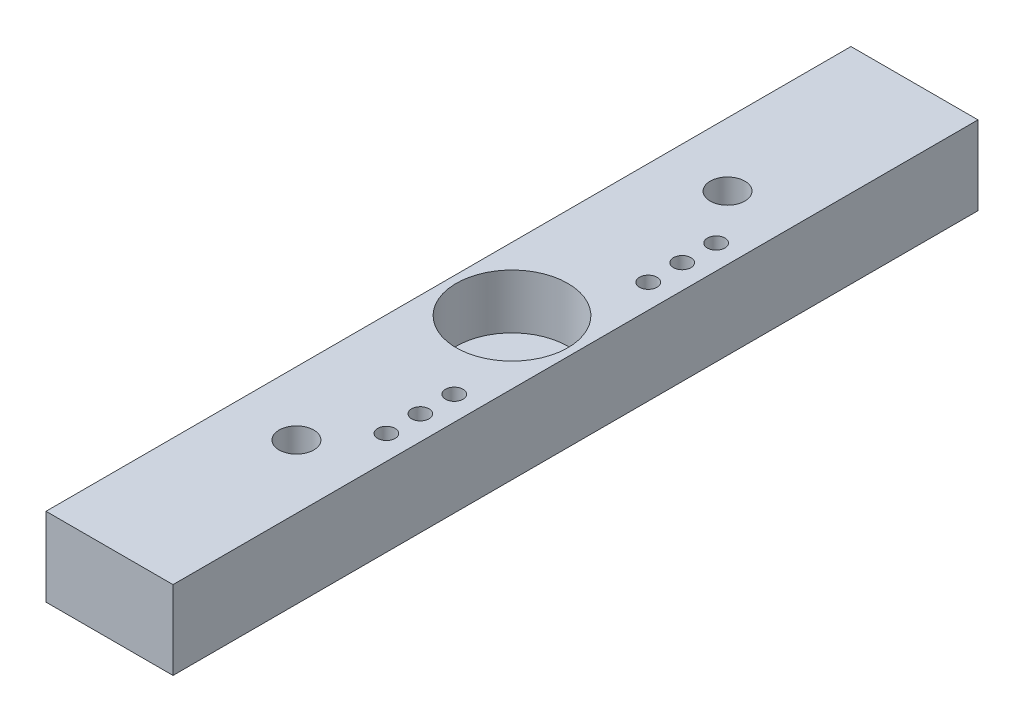
from build123d import *

# Parameters (mm, degrees)
SKETCH1_W         = 38.1
SKETCH1_H         = 166
SKETCH1_R         = 11.509375
SKETCH1_R_2       = 3.571875
EXTRUSION1_DEPTH  = 25.4
EXTRUSION15_REACH = 171.009
SKETCH2_W         = 38.1
SKETCH2_H         = 9.170812283
EXTRUSION18_REACH = 90.865
SKETCH4_R         = 1.8
SKETCH4_W         = 5.953125
SKETCH4_H         = 166
SKETCH5_R         = 3.571875
SKETCH5_R_2       = 11.509375
EXTRUSION19_DEPTH = 5


with BuildPart() as part:
    # Sketch1 → Extrusion1 (new body)
    with BuildSketch(Plane(origin=(0, 0, 0), x_dir=(-1, 0, 0), z_dir=(0, 1, 0))):
        Rectangle(SKETCH1_W, SKETCH1_H)
        with Locations(Location((0, 0, 0), (0, 0, 270))):
            Circle(SKETCH1_R, mode=Mode.SUBTRACT)
        with Locations(Location((0, -44.45, 0), (0, 0, 270))):
            Circle(SKETCH1_R_2, mode=Mode.SUBTRACT)
        with Locations(Location((0, 44.45, 0), (0, 0, 270))):
            Circle(SKETCH1_R_2, mode=Mode.SUBTRACT)
    extrude(amount=EXTRUSION1_DEPTH)

    # Sketch2 → Extrusion15 (cut, up to next)
    with BuildSketch(Plane(origin=(0, 0, -83), x_dir=(-1, 0, 0), z_dir=(0, 0, -1)), mode=Mode.PRIVATE) as extrusion15_sk1:
        with Locations((0, 20.814593859)):
            Rectangle(SKETCH2_W, SKETCH2_H)
    extrusion15_tool1 = extrude(extrusion15_sk1.sketch, amount=-EXTRUSION15_REACH, mode=Mode.PRIVATE) & part.part
    add(extrusion15_tool1.solids().sort_by_distance((0, 20.814594, -83))[0], mode=Mode.SUBTRACT)

    # Sketch4 → Extrusion18 (cut, up to next)
    with BuildSketch(Plane(origin=(0, 25.4, 0), x_dir=(1, 0, 0), z_dir=(0, 1, 0)), mode=Mode.PRIVATE) as extrusion18_sk1:
        with Locations(Location((8.096875, -34, 0), (0, 0, 270))):
            Circle(SKETCH4_R)
    extrusion18_tool1 = extrude(extrusion18_sk1.sketch, amount=-EXTRUSION18_REACH, mode=Mode.PRIVATE) & part.part
    # Sketch4 → Extrusion18 (cut, up to next)
    with BuildSketch(Plane(origin=(0, 25.4, 0), x_dir=(1, 0, 0), z_dir=(0, 1, 0)), mode=Mode.PRIVATE) as extrusion18_sk2:
        with Locations(Location((8.096875, -27, 0), (0, 0, 270))):
            Circle(SKETCH4_R)
    extrusion18_tool2 = extrude(extrusion18_sk2.sketch, amount=-EXTRUSION18_REACH, mode=Mode.PRIVATE) & part.part
    # Sketch4 → Extrusion18 (cut, up to next)
    with BuildSketch(Plane(origin=(0, 25.4, 0), x_dir=(1, 0, 0), z_dir=(0, 1, 0)), mode=Mode.PRIVATE) as extrusion18_sk3:
        with Locations(Location((8.096875, -20, 0), (0, 0, 270))):
            Circle(SKETCH4_R)
    extrusion18_tool3 = extrude(extrusion18_sk3.sketch, amount=-EXTRUSION18_REACH, mode=Mode.PRIVATE) & part.part
    # Sketch4 → Extrusion18 (cut, up to next)
    with BuildSketch(Plane(origin=(0, 25.4, 0), x_dir=(1, 0, 0), z_dir=(0, 1, 0)), mode=Mode.PRIVATE) as extrusion18_sk4:
        with Locations(Location((8.096875, 20, 0), (0, 0, 270))):
            Circle(SKETCH4_R)
    extrusion18_tool4 = extrude(extrusion18_sk4.sketch, amount=-EXTRUSION18_REACH, mode=Mode.PRIVATE) & part.part
    # Sketch4 → Extrusion18 (cut, up to next)
    with BuildSketch(Plane(origin=(0, 25.4, 0), x_dir=(1, 0, 0), z_dir=(0, 1, 0)), mode=Mode.PRIVATE) as extrusion18_sk5:
        with Locations(Location((8.096875, 27, 0), (0, 0, 270))):
            Circle(SKETCH4_R)
    extrusion18_tool5 = extrude(extrusion18_sk5.sketch, amount=-EXTRUSION18_REACH, mode=Mode.PRIVATE) & part.part
    # Sketch4 → Extrusion18 (cut, up to next)
    with BuildSketch(Plane(origin=(0, 25.4, 0), x_dir=(1, 0, 0), z_dir=(0, 1, 0)), mode=Mode.PRIVATE) as extrusion18_sk6:
        with Locations(Location((8.096875, 34, 0), (0, 0, 270))):
            Circle(SKETCH4_R)
    extrusion18_tool6 = extrude(extrusion18_sk6.sketch, amount=-EXTRUSION18_REACH, mode=Mode.PRIVATE) & part.part
    # Sketch4 → Extrusion18 (cut, up to next)
    with BuildSketch(Plane(origin=(0, 25.4, 0), x_dir=(1, 0, 0), z_dir=(0, 1, 0)), mode=Mode.PRIVATE) as extrusion18_sk7:
        with Locations((-16.0734375, 0)):
            Rectangle(SKETCH4_W, SKETCH4_H)
    extrusion18_tool7 = extrude(extrusion18_sk7.sketch, amount=-EXTRUSION18_REACH, mode=Mode.PRIVATE) & part.part
    # Sketch4 → Extrusion18 (cut, up to next)
    with BuildSketch(Plane(origin=(0, 25.4, 0), x_dir=(1, 0, 0), z_dir=(0, 1, 0)), mode=Mode.PRIVATE) as extrusion18_sk8:
        with Locations((16.0734375, 0)):
            Rectangle(SKETCH4_W, SKETCH4_H)
    extrusion18_tool8 = extrude(extrusion18_sk8.sketch, amount=-EXTRUSION18_REACH, mode=Mode.PRIVATE) & part.part
    add(extrusion18_tool1.solids().sort_by_distance((8.096875, 25.4, 34))[0], mode=Mode.SUBTRACT)
    add(extrusion18_tool2.solids().sort_by_distance((8.096875, 25.4, 27))[0], mode=Mode.SUBTRACT)
    add(extrusion18_tool3.solids().sort_by_distance((8.096875, 25.4, 20))[0], mode=Mode.SUBTRACT)
    add(extrusion18_tool4.solids().sort_by_distance((8.096875, 25.4, -20))[0], mode=Mode.SUBTRACT)
    add(extrusion18_tool5.solids().sort_by_distance((8.096875, 25.4, -27))[0], mode=Mode.SUBTRACT)
    add(extrusion18_tool6.solids().sort_by_distance((8.096875, 25.4, -34))[0], mode=Mode.SUBTRACT)
    add(extrusion18_tool7.solids().sort_by_distance((-16.073437, 25.4, 0))[0], mode=Mode.SUBTRACT)
    add(extrusion18_tool8.solids().sort_by_distance((16.073438, 25.4, 0))[0], mode=Mode.SUBTRACT)

    # Sketch5 → Extrusion19 (add)
    with BuildSketch(Plane.XZ):
        with Locations(Location((0, 44.45, 0), (0, 0, 270))):
            Circle(SKETCH5_R)
        with Locations(Location((0, -44.45, 0), (0, 0, 270))):
            Circle(SKETCH5_R)
        with Locations(Location((0, 0, 0), (0, 0, 270))):
            Circle(SKETCH5_R_2)
    extrude(amount=-EXTRUSION19_DEPTH)


solid = part.part
